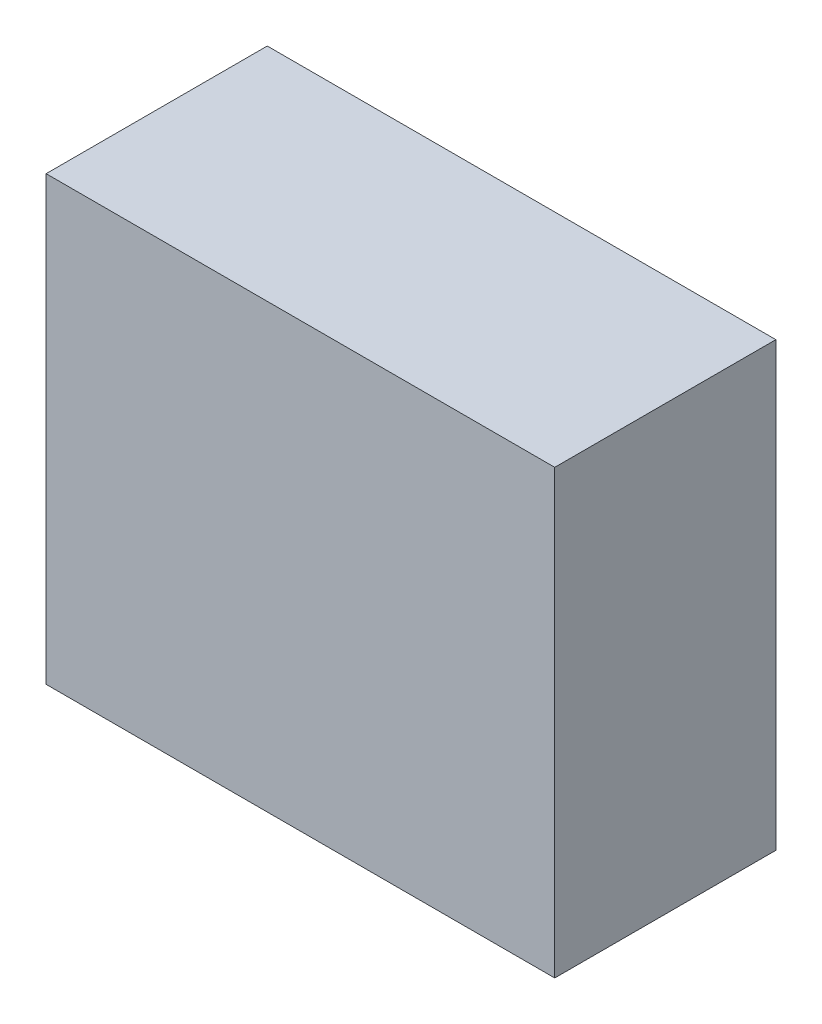
from build123d import *

# Parameters (mm, degrees)
SKETCH1_W           = 23
SKETCH1_H           = 20
BOSS_EXTRUDE1_DEPTH = 10


with BuildPart() as part:
    # Sketch1 → Boss-Extrude1 (new body)
    with BuildSketch(Plane.XY):
        with Locations((11.5, 10)):
            Rectangle(SKETCH1_W, SKETCH1_H)
    extrude(amount=-BOSS_EXTRUDE1_DEPTH)


solid = part.part
